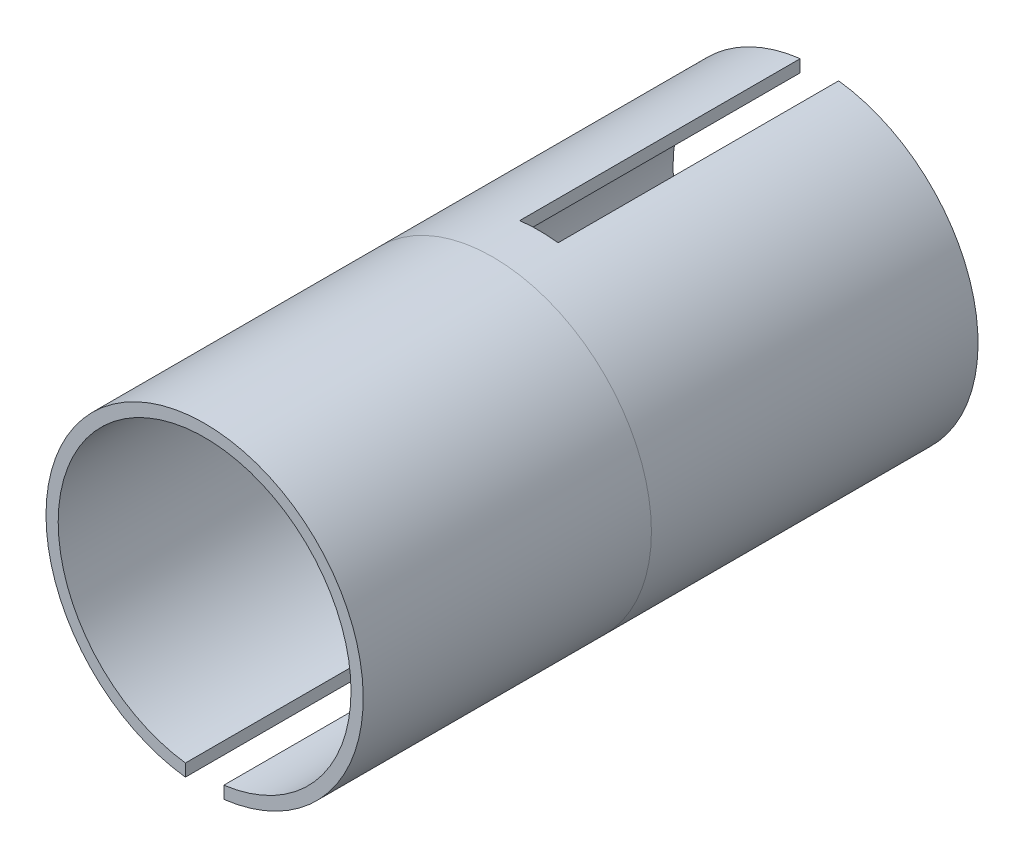
from build123d import *

# Parameters (mm, degrees)
SKETCH1_R           = 41.275
SKETCH1_R_2         = 38.1
BOSS_EXTRUDE1_DEPTH = 160
SKETCH2_W           = 10
SKETCH2_H           = 60
CUT_EXTRUDE1_DEPTH  = 50
SKETCH3_W           = 10
SKETCH3_H           = 73
CUT_EXTRUDE2_DEPTH  = 50


with BuildPart() as part:
    # Sketch1 → Boss-Extrude1 (new body)
    with BuildSketch(Plane.XY):
        Circle(SKETCH1_R)
        Circle(SKETCH1_R_2, mode=Mode.SUBTRACT)
    extrude(amount=BOSS_EXTRUDE1_DEPTH)

    # Sketch2 → Cut-Extrude1 (cut)
    with BuildSketch(Plane(origin=(0, 0, 0), x_dir=(1, 0, 0), z_dir=(0, 1, 0))):
        with Locations((0, -130)):
            Rectangle(SKETCH2_W, SKETCH2_H)
    extrude(amount=-CUT_EXTRUDE1_DEPTH, mode=Mode.SUBTRACT)

    # Sketch3 → Cut-Extrude2 (cut)
    with BuildSketch(Plane(origin=(0, 0, 0), x_dir=(1, 0, 0), z_dir=(0, 1, 0))):
        with Locations((0, -36.5)):
            Rectangle(SKETCH3_W, SKETCH3_H)
    extrude(amount=CUT_EXTRUDE2_DEPTH, mode=Mode.SUBTRACT)


with BuildPart() as body_2:
    # Split1: the piece on the far side of the plane
    add(part.part)
    split(bisect_by=Plane(origin=(0, 0, 85), x_dir=(-1, 0, 0), z_dir=(0, 0, -1)), keep=Keep.BOTTOM)


with BuildPart() as part_1:
    add(part.part)

    # Split1
    split(bisect_by=Plane(origin=(0, 0, 85), x_dir=(-1, 0, 0), z_dir=(0, 0, -1)), keep=Keep.TOP)


solid = Compound([body_2.part, part_1.part])
